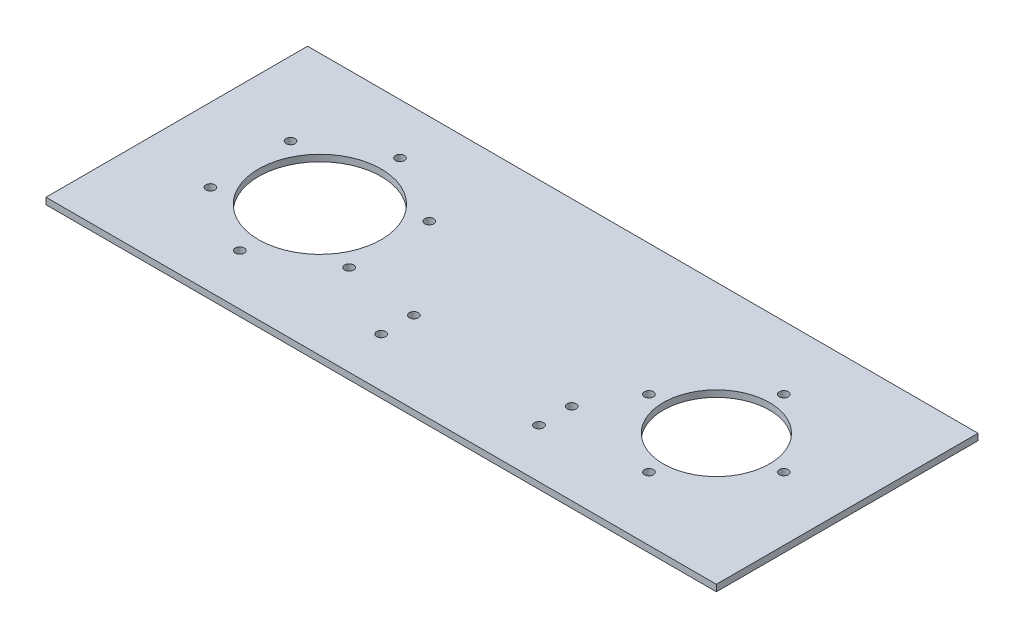
from build123d import *

# Parameters (mm, degrees)
SKETCH1_W           = 820
SKETCH1_H           = 320
SKETCH1_R           = 75
SKETCH1_R_2         = 5.5
SKETCH1_R_3         = 65
BOSS_EXTRUDE1_DEPTH = 8
SKETCH2_R           = 5.5
CUT_EXTRUDE2_DEPTH  = 10


with BuildPart() as part:
    # Sketch1 → Boss-Extrude1 (new body)
    with BuildSketch(Plane(origin=(0, 0, 0), x_dir=(1, 0, 0), z_dir=(0, 1, 0))):
        with Locations((235, 0)):
            Rectangle(SKETCH1_W, SKETCH1_H)
        with Locations(Location((0, 0, 0), (0, 0, 270))):
            Circle(SKETCH1_R, mode=Mode.SUBTRACT)
        with Locations(Location((0, -98, 0), (0, 0, 270))):
            Circle(SKETCH1_R_2, mode=Mode.SUBTRACT)
        with Locations(Location((-84.870489571, -49, 0), (0, 0, 270))):
            Circle(SKETCH1_R_2, mode=Mode.SUBTRACT)
        with Locations(Location((-84.870489571, 49, 0), (0, 0, 270))):
            Circle(SKETCH1_R_2, mode=Mode.SUBTRACT)
        with Locations(Location((0, 98, 0), (0, 0, 270))):
            Circle(SKETCH1_R_2, mode=Mode.SUBTRACT)
        with Locations(Location((84.870489571, 49, 0), (0, 0, 270))):
            Circle(SKETCH1_R_2, mode=Mode.SUBTRACT)
        with Locations(Location((84.870489571, -49, 0), (0, 0, 270))):
            Circle(SKETCH1_R_2, mode=Mode.SUBTRACT)
        with Locations(Location((485, 0, 0), (0, 0, 270))):
            Circle(SKETCH1_R_3, mode=Mode.SUBTRACT)
        with Locations(Location((567.5, 0, 0), (0, 0, 270))):
            Circle(SKETCH1_R_2, mode=Mode.SUBTRACT)
        with Locations(Location((485, -82.5, 0), (0, 0, 270))):
            Circle(SKETCH1_R_2, mode=Mode.SUBTRACT)
        with Locations(Location((402.5, 0, 0), (0, 0, 270))):
            Circle(SKETCH1_R_2, mode=Mode.SUBTRACT)
        with Locations(Location((485, 82.5, 0), (0, 0, 270))):
            Circle(SKETCH1_R_2, mode=Mode.SUBTRACT)
    extrude(amount=BOSS_EXTRUDE1_DEPTH)

    # Sketch2 → Cut-Extrude2 (cut)
    with BuildSketch(Plane(origin=(0, 0, 0), x_dir=(1, 0, 0), z_dir=(0, 1, 0))):
        with Locations(Location((175, -60, 0), (0, 0, 270))):
            Circle(SKETCH2_R)
        with Locations(Location((175, -100, 0), (0, 0, 270))):
            Circle(SKETCH2_R)
        with Locations(Location((368, -100, 0), (0, 0, 270))):
            Circle(SKETCH2_R)
        with Locations(Location((368, -60, 0), (0, 0, 270))):
            Circle(SKETCH2_R)
    extrude(amount=CUT_EXTRUDE2_DEPTH, mode=Mode.SUBTRACT)


solid = part.part
